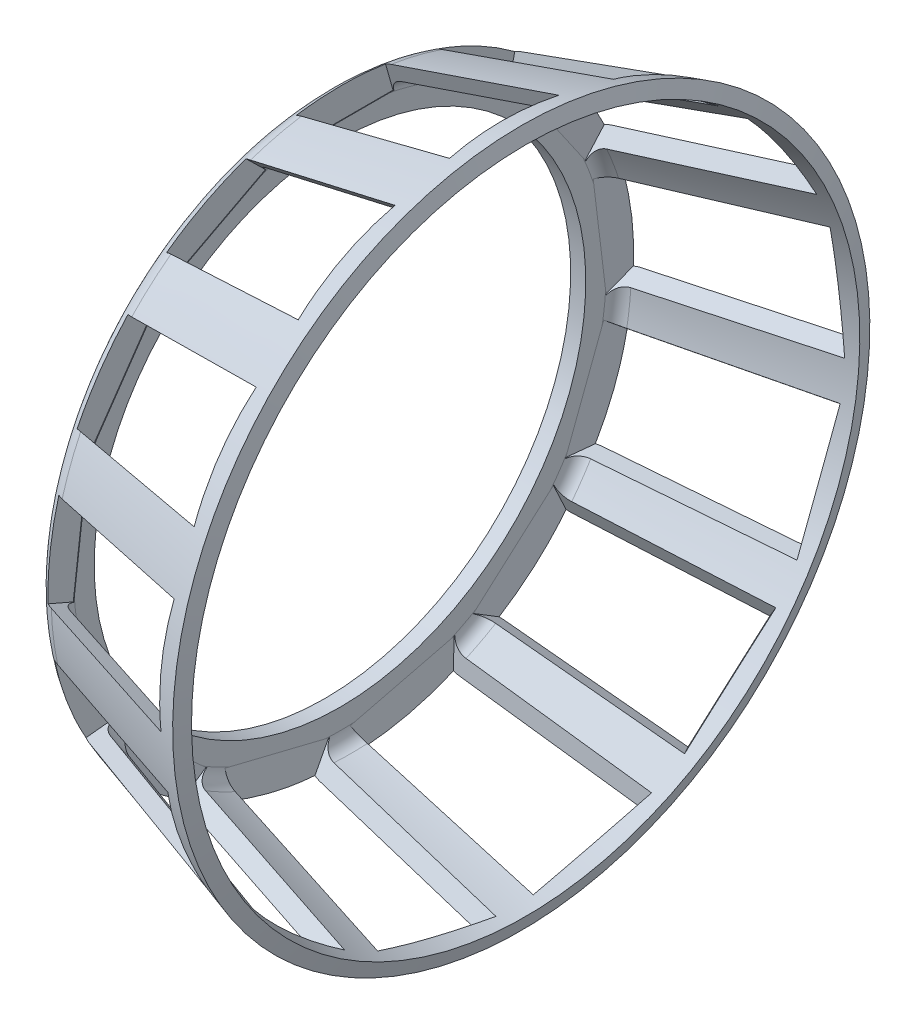
from build123d import *

# Parameters (mm, degrees)
ENL_V_MAT_EXTRU_1_DEPTH      = 2
ENL_V_MAT_EXTRU_1_TAPER      = -20
R_P_TITION_CIRCULAIRE1_COUNT = 13


with BuildPart() as part:
    # Esquisse1 → Base-Révolution (revolve)
    with BuildSketch(Plane.XY):
        with BuildLine():
            Line((-14.780440552, 19.546148309), (-3.189952461, 23.089716132))
            Line((-3.189952461, 23.089716132), (-2.897580757, 22.133411376))
            Line((-2.897580757, 22.133411376), (-14.488068847, 18.589843553))
            ThreePointArc((-14.488068847, 18.589843553), (-14.999554003, 18.228361584), (-15.195697142, 17.633538798))
            Line((-15.195697142, 17.633538798), (-15.195697142, 16.28211636))
            Line((-15.195697142, 16.28211636), (-16.195697142, 16.28211636))
            Line((-16.195697142, 16.28211636), (-16.195697142, 17.633538798))
            ThreePointArc((-16.195697142, 17.633538798), (-15.803410864, 18.823184371), (-14.780440552, 19.546148309))
        make_face()
    revolve(axis=Axis((-3.385649604, 0, 0), (-1, 0, 0)))

    # Esquisse4 → Enlèv. mat.-Extru.1 (cut)
    with BuildSketch(Plane(origin=(-8.985196507, 21.317932221, 0), x_dir=(0, 0, -1), z_dir=(-0.2923717047227306, 0.9563047559630373, 0))):
        Polygon((2.878119838, 6.428917365), (-2.878119838, 6.428917365), (-3.51264028, -4.690191573), (3.51264028, -4.690191573), align=None)
    enl_v_mat_extru_1 = extrude(amount=-ENL_V_MAT_EXTRU_1_DEPTH, taper=ENL_V_MAT_EXTRU_1_TAPER, mode=Mode.SUBTRACT)

    # Répétition circulaire1: Enlèv. mat.-Extru.1 ×13 about axis
    r_p_tition_circulaire1_axis = Axis((-3.385649604, 0, 0), (-1, 0, 0))
    for i in range(1, R_P_TITION_CIRCULAIRE1_COUNT):
        add(enl_v_mat_extru_1.rotate(r_p_tition_circulaire1_axis, i * 360 / R_P_TITION_CIRCULAIRE1_COUNT), mode=Mode.SUBTRACT)


solid = part.part
